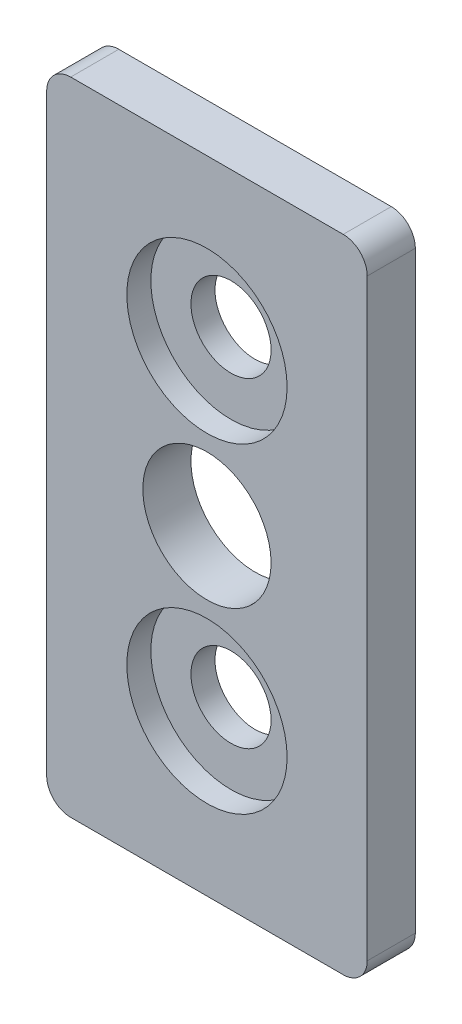
from build123d import *

# Parameters (mm, degrees)
SKETCH1_W           = 20
SKETCH1_H           = 40
SKETCH1_R           = 2.5
SKETCH1_R_2         = 4
BOSS_EXTRUDE1_DEPTH = 3
SKETCH2_R           = 5
CUT_EXTRUDE1_DEPTH  = 1.5
FILLET1_R           = 1.5


with BuildPart() as part:
    # Sketch1 → Boss-Extrude1 (new body)
    with BuildSketch(Plane.XY):
        Rectangle(SKETCH1_W, SKETCH1_H)
        with Locations((0, -10)):
            Circle(SKETCH1_R, mode=Mode.SUBTRACT)
        with Locations((0, 10)):
            Circle(SKETCH1_R, mode=Mode.SUBTRACT)
        Circle(SKETCH1_R_2, mode=Mode.SUBTRACT)
    extrude(amount=BOSS_EXTRUDE1_DEPTH)

    # Sketch2 → Cut-Extrude1 (cut)
    with BuildSketch(Plane.XY.offset(3)):
        with Locations((0, -10)):
            Circle(SKETCH2_R)
        with Locations((0, 10)):
            Circle(SKETCH2_R)
    extrude(amount=-CUT_EXTRUDE1_DEPTH, mode=Mode.SUBTRACT)

    # Fillet1
    fillet1_edges = [part.edges().sort_by_distance(p)[0] for p in [
        (-10, 20, 1.5),
        (10, 20, 1.5),
        (10, -20, 1.5),
        (-10, -20, 1.5),
    ]]
    fillet(fillet1_edges, radius=FILLET1_R)


solid = part.part
